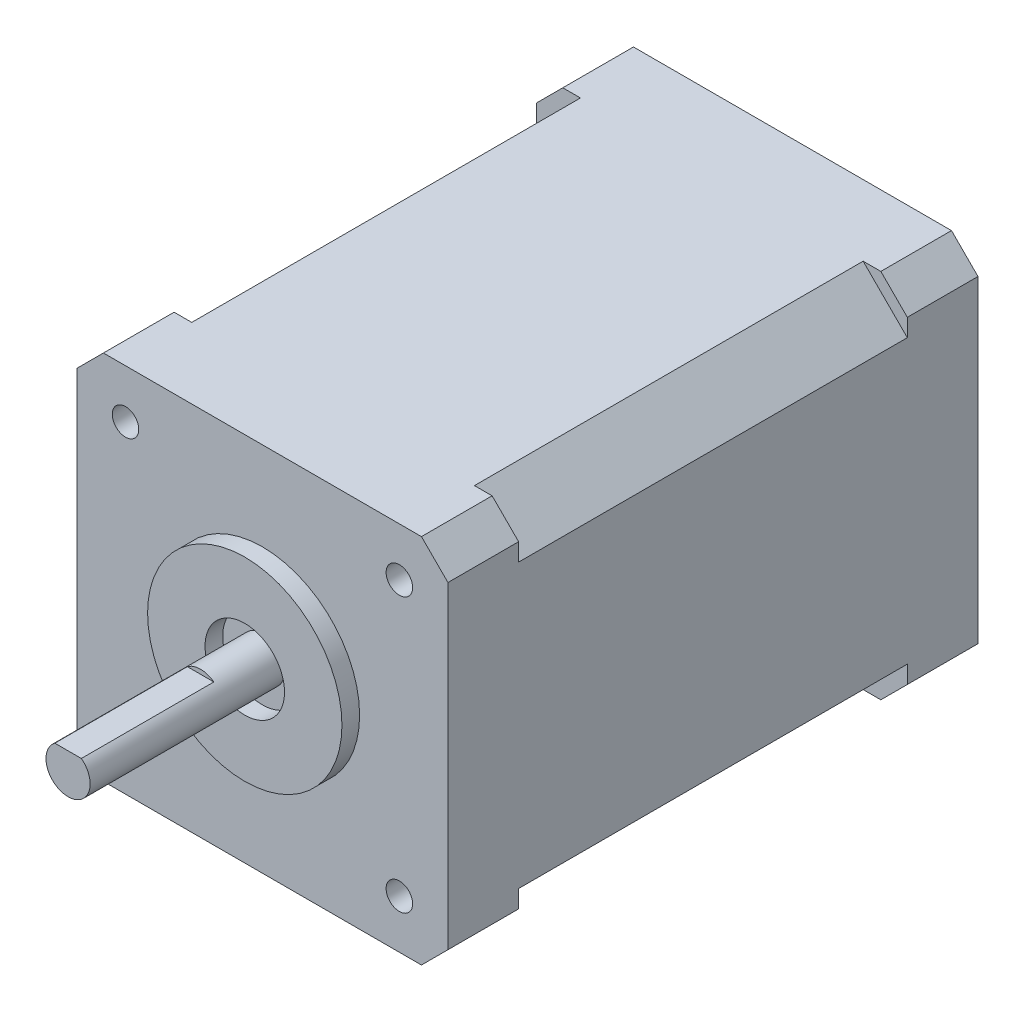
from build123d import *

# Parameters (mm, degrees)
SALIENTE_EXTRUIR1_DEPTH = 44
SALIENTE_EXTRUIR2_DEPTH = 8
SALIENTE_EXTRUIR3_DEPTH = 8
CROQUIS4_R              = 11
CROQUIS4_R_2            = 4.5
SALIENTE_EXTRUIR4_DEPTH = 2
CROQUIS5_R              = 2.5
SALIENTE_EXTRUIR5_DEPTH = 22
CORTAR_EXTRUIR1_START   = -15
CORTAR_EXTRUIR1_DEPTH   = 15
CROQUIS7_R              = 1.5
CORTAR_EXTRUIR2_DEPTH   = 4


with BuildPart() as part:
    # Croquis1 → Saliente-Extruir1 (new body)
    with BuildSketch(Plane.XY):
        Polygon((-21, 16), (-16, 21), (16, 21), (21, 16), (21, -16), (16, -21), (-16, -21), (-21, -16), align=None)
    extrude(amount=SALIENTE_EXTRUIR1_DEPTH)

    # Croquis2 → Saliente-Extruir2 (add)
    with BuildSketch(Plane.XY.offset(44)):
        Polygon((-21, 18), (-18, 21), (18, 21), (21, 18), (21, -18), (18, -21), (-18, -21), (-21, -18), align=None)
    extrude(amount=SALIENTE_EXTRUIR2_DEPTH)

    # Croquis3 → Saliente-Extruir3 (add)
    with BuildSketch(Plane(origin=(0, 0, 0), x_dir=(-1, 0, 0), z_dir=(0, 0, -1))):
        Polygon((-21, 18), (-18, 21), (18, 21), (21, 18), (21, -18), (18, -21), (-18, -21), (-21, -18), align=None)
    extrude(amount=SALIENTE_EXTRUIR3_DEPTH)

    # Croquis4 → Saliente-Extruir4 (add)
    with BuildSketch(Plane.XY.offset(52)):
        with Locations(Location((0, 0, 0), (0, 0, 180))):
            Circle(CROQUIS4_R)
        Circle(CROQUIS4_R_2, mode=Mode.SUBTRACT)
    extrude(amount=SALIENTE_EXTRUIR4_DEPTH)

    # Croquis5 → Saliente-Extruir5 (add)
    with BuildSketch(Plane.XY.offset(52)):
        with Locations(Location((0, 0, 0), (0, 0, 180))):
            Circle(CROQUIS5_R)
    extrude(amount=SALIENTE_EXTRUIR5_DEPTH)

    # Croquis6 → Cortar-Extruir1 (cut)
    with BuildSketch(Plane.XY.offset(74).offset(CORTAR_EXTRUIR1_START)):
        with BuildLine():
            Line((-1.5, 2), (1.5, 2))
            ThreePointArc((1.5, 2), (0, 2.5), (-1.5, 2))
        make_face()
    extrude(amount=CORTAR_EXTRUIR1_DEPTH, mode=Mode.SUBTRACT)

    # Croquis7 → Cortar-Extruir2 (cut)
    with BuildSketch(Plane.XY.offset(52)):
        with Locations((-15.5, 15.5)):
            Circle(CROQUIS7_R)
        with Locations((15.5, 15.5)):
            Circle(CROQUIS7_R)
        with Locations((15.5, -15.5)):
            Circle(CROQUIS7_R)
        with Locations((-15.5, -15.5)):
            Circle(CROQUIS7_R)
    extrude(amount=-CORTAR_EXTRUIR2_DEPTH, mode=Mode.SUBTRACT)


solid = part.part
